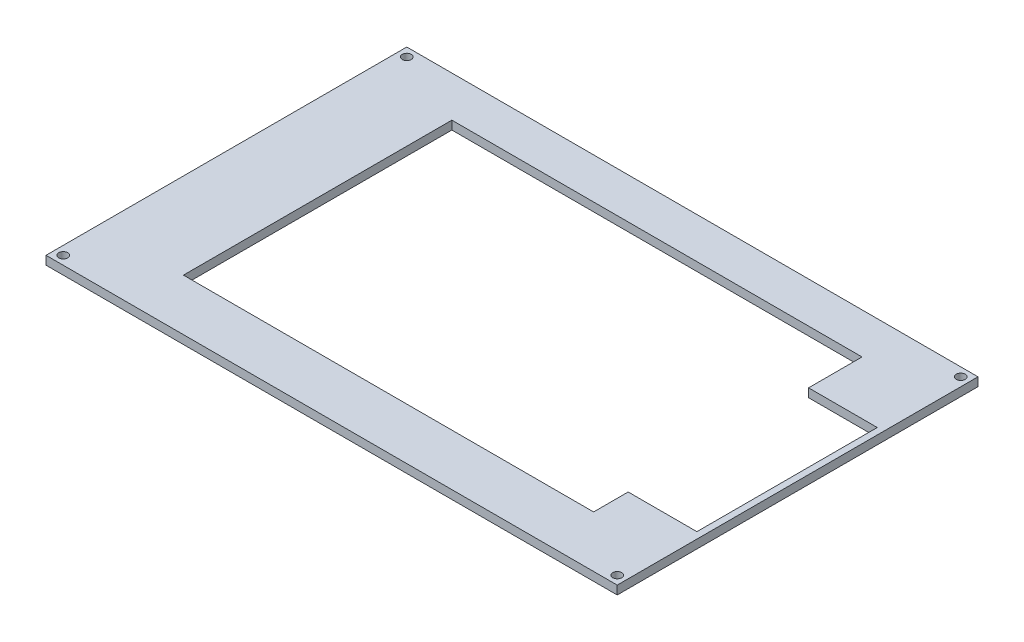
from build123d import *

# Parameters (mm, degrees)
SKETCH_1_W      = 133
SKETCH_1_H      = 84
SKETCH_1_R      = 1.05
EXTRUDE_1_DEPTH = 2


with BuildPart() as part:
    # 草图1 → 凸台-拉伸1 (new body)
    with BuildSketch(Plane(origin=(0, 0, 0), x_dir=(1, 0, 0), z_dir=(0, 1, 0))):
        with Locations((66.5, -42)):
            Rectangle(SKETCH_1_W, SKETCH_1_H)
        with Locations(Location((2, -82, 0), (0, 0, 270))):
            Circle(SKETCH_1_R, mode=Mode.SUBTRACT)
        with Locations(Location((131, -82, 0), (0, 0, 270))):
            Circle(SKETCH_1_R, mode=Mode.SUBTRACT)
        with Locations(Location((2, -2, 0), (0, 0, 270))):
            Circle(SKETCH_1_R, mode=Mode.SUBTRACT)
        Polygon((20, -72), (20, -9.5), (115.5, -9.5), (115.5, -21.95), (131.5, -21.95), (131.5, -63.95), (115.5, -63.95), (115.5, -72), align=None, mode=Mode.SUBTRACT)
        with Locations(Location((131, -2, 0), (0, 0, 270))):
            Circle(SKETCH_1_R, mode=Mode.SUBTRACT)
    extrude(amount=EXTRUDE_1_DEPTH)


solid = part.part
